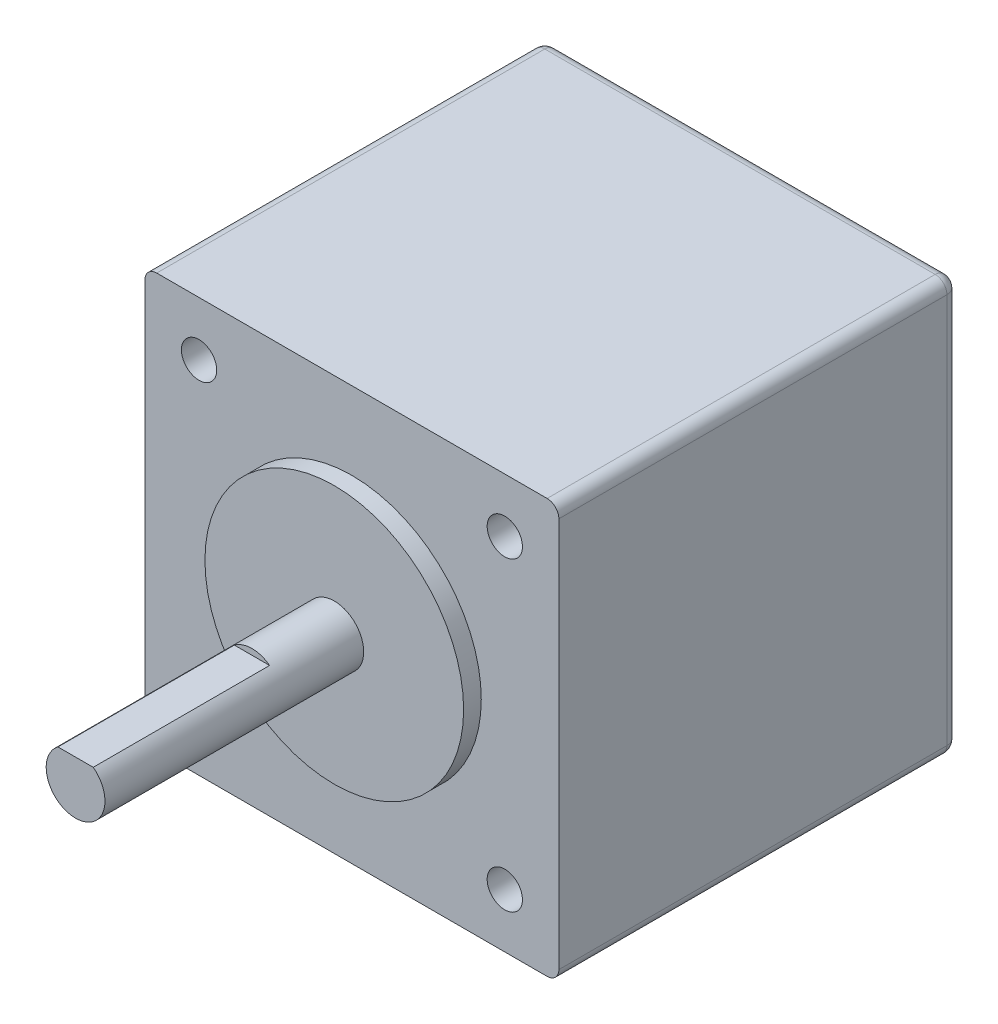
from build123d import *

# Parameters (mm, degrees)
SKETCH1_W           = 35.2
SKETCH1_H           = 35.2
BOSS_EXTRUDE1_DEPTH = 34
SKETCH2_R           = 11
BOSS_EXTRUDE2_DEPTH = 1.5
SKETCH3_R           = 2.5
BOSS_EXTRUDE3_DEPTH = 22
SKETCH4_W           = 15
SKETCH4_H           = 0.5
CUT_EXTRUDE1_DEPTH  = 5
SKETCH5_R           = 1.5
CUT_EXTRUDE2_DEPTH  = 4.5
FILLET1_R           = 1


with BuildPart() as part:
    # Sketch1 → Boss-Extrude1 (new body)
    with BuildSketch(Plane.XY):
        Rectangle(SKETCH1_W, SKETCH1_H)
    extrude(amount=BOSS_EXTRUDE1_DEPTH)

    # Sketch2 → Boss-Extrude2 (add)
    with BuildSketch(Plane.XY.offset(34)):
        with Locations(Location((0, 0, 0), (0, 0, 180))):
            Circle(SKETCH2_R)
    extrude(amount=BOSS_EXTRUDE2_DEPTH)

    # Sketch3 → Boss-Extrude3 (add)
    with BuildSketch(Plane.XY.offset(35.5)):
        Circle(SKETCH3_R)
    extrude(amount=BOSS_EXTRUDE3_DEPTH)

    # Sketch4 → Cut-Extrude1 (cut, symmetric)
    with BuildSketch(Plane(origin=(0, 0, 0), x_dir=(0, 0, -1), z_dir=(1, 0, 0))):
        with Locations((-50, 2.25)):
            Rectangle(SKETCH4_W, SKETCH4_H)
    extrude(amount=CUT_EXTRUDE1_DEPTH, both=True, mode=Mode.SUBTRACT)

    # Sketch5 → Cut-Extrude2 (cut)
    with BuildSketch(Plane.XY.offset(34)):
        with Locations((-13, 13)):
            Circle(SKETCH5_R)
        with Locations((13, 13)):
            Circle(SKETCH5_R)
        with Locations((13, -13)):
            Circle(SKETCH5_R)
        with Locations((-13, -13)):
            Circle(SKETCH5_R)
    extrude(amount=-CUT_EXTRUDE2_DEPTH, mode=Mode.SUBTRACT)

    # Fillet1
    fillet1_edges = [part.edges().sort_by_distance(p)[0] for p in [
        (0, -17.6, 0),
        (-17.6, 0, 0),
        (0, 17.6, 0),
        (17.6, 0, 0),
        (17.6, -17.6, 17),
        (-17.6, -17.6, 17),
        (-17.6, 17.6, 17),
        (17.6, 17.6, 17),
    ]]
    fillet(fillet1_edges, radius=FILLET1_R)


solid = part.part
